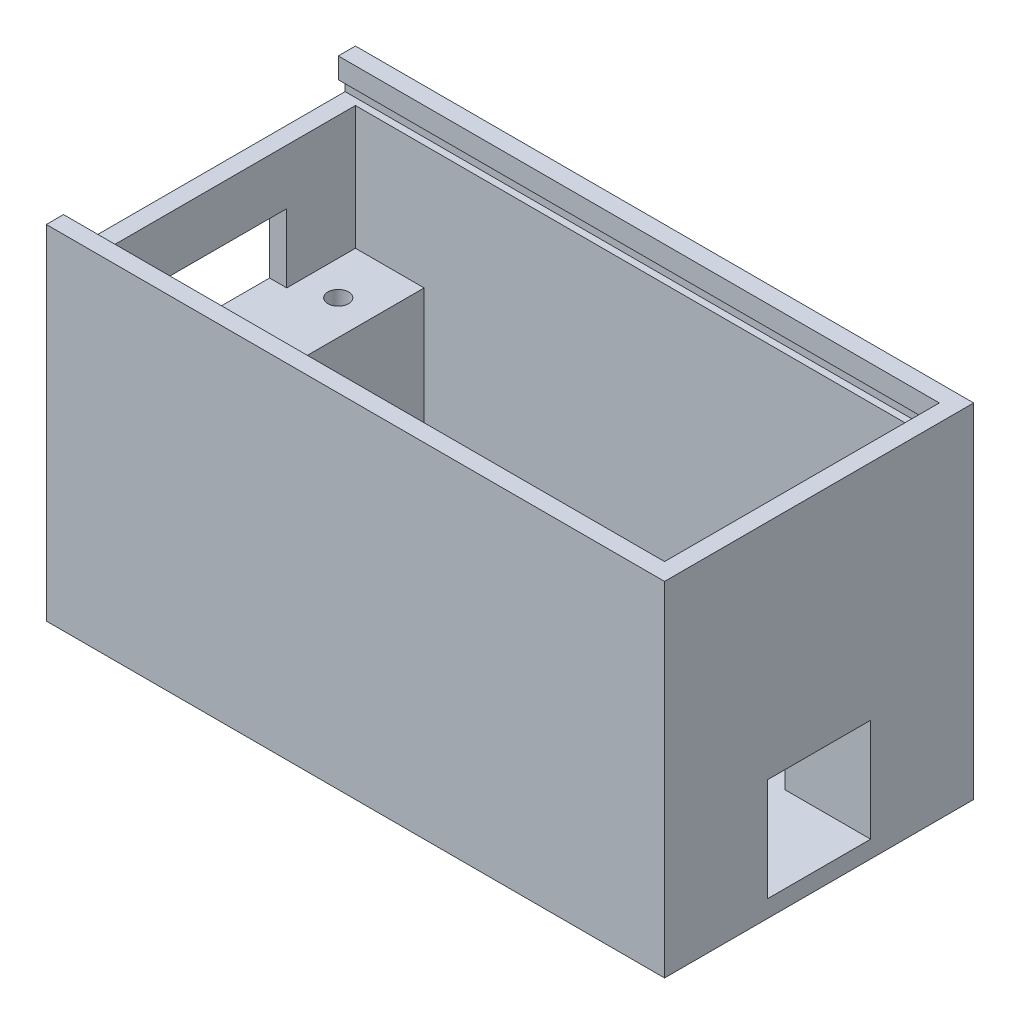
from build123d import *

# Parameters (mm, degrees)
SKETCH1_W           = 90
SKETCH1_H           = 45
BOSS_EXTRUDE1_DEPTH = 50
SHELL1_T            = -2.5
SKETCH2_W           = 40
SKETCH2_H           = 24.5
BOSS_EXTRUDE2_DEPTH = 10
SKETCH3_W           = 40
SKETCH3_H           = 19.5
BOSS_EXTRUDE3_DEPTH = 10
SKETCH9_W           = 20
SKETCH9_H           = 10
CUT_EXTRUDE3_DEPTH  = 2.5
SKETCH13_W          = 40
SKETCH13_H          = 5
CUT_EXTRUDE6_DEPTH  = 2.5
SKETCH14_W          = 87.5
SKETCH14_H          = 2
CUT_EXTRUDE7_DEPTH  = 1
SKETCH15_W          = 87.5
SKETCH15_H          = 2
CUT_EXTRUDE8_DEPTH  = 1
SKETCH17_R          = 1.5
CUT_EXTRUDE9_DEPTH  = 27
SKETCH18_R          = 1.5
CUT_EXTRUDE10_DEPTH = 27
SKETCH20_R          = 1.5
CUT_EXTRUDE11_DEPTH = 22
SKETCH21_R          = 1.5
CUT_EXTRUDE12_DEPTH = 22
SKETCH22_R          = 3
CUT_EXTRUDE13_DEPTH = 5
SKETCH26_W          = 15
SKETCH26_H          = 15
CUT_EXTRUDE14_DEPTH = 12.5


with BuildPart() as part:
    # Sketch1 → Boss-Extrude1 (new body)
    with BuildSketch(Plane(origin=(0, 0, 0), x_dir=(1, 0, 0), z_dir=(0, 1, 0))):
        with Locations((4.862356655, 3.4550978)):
            Rectangle(SKETCH1_W, SKETCH1_H)
    extrude(amount=BOSS_EXTRUDE1_DEPTH)

    # Shell1
    shell1_openings = [part.faces().sort_by_distance(p)[0] for p in [
        (4.862356655, 50, -3.4550978),
    ]]
    offset(amount=SHELL1_T, openings=shell1_openings, kind=Kind.INTERSECTION)

    # Sketch2 → Boss-Extrude2 (add)
    with BuildSketch(Plane(origin=(-37.637643345, 0, 0), x_dir=(0, 0, -1), z_dir=(1, 0, 0))):
        with Locations((3.4550978, 14.75)):
            Rectangle(SKETCH2_W, SKETCH2_H)
    extrude(amount=BOSS_EXTRUDE2_DEPTH)

    # Sketch3 → Boss-Extrude3 (add)
    with BuildSketch(Plane.ZY.offset(-47.362356655)):
        with Locations((-3.4550978, 12.25)):
            Rectangle(SKETCH3_W, SKETCH3_H)
    extrude(amount=BOSS_EXTRUDE3_DEPTH)

    # Sketch9 → Cut-Extrude3 (cut)
    with BuildSketch(Plane(origin=(-37.637643345, 0, 0), x_dir=(0, 0, -1), z_dir=(1, 0, 0))):
        with Locations((3.4550978, 32)):
            Rectangle(SKETCH9_W, SKETCH9_H)
    extrude(amount=-CUT_EXTRUDE3_DEPTH, mode=Mode.SUBTRACT)

    # Sketch13 → Cut-Extrude6 (cut)
    with BuildSketch(Plane(origin=(-37.637643345, 0, 0), x_dir=(0, 0, -1), z_dir=(1, 0, 0))):
        with Locations((3.4550978, 47.5)):
            Rectangle(SKETCH13_W, SKETCH13_H)
    extrude(amount=-CUT_EXTRUDE6_DEPTH, mode=Mode.SUBTRACT)

    # Sketch14 → Cut-Extrude7 (cut)
    with BuildSketch(Plane.XY.offset(-23.4550978)):
        with Locations((3.612356655, 46)):
            Rectangle(SKETCH14_W, SKETCH14_H)
    extrude(amount=-CUT_EXTRUDE7_DEPTH, mode=Mode.SUBTRACT)

    # Sketch15 → Cut-Extrude8 (cut)
    with BuildSketch(Plane(origin=(0, 0, 16.5449022), x_dir=(-1, 0, 0), z_dir=(0, 0, -1))):
        with Locations((-3.612356655, 46)):
            Rectangle(SKETCH15_W, SKETCH15_H)
    extrude(amount=-CUT_EXTRUDE8_DEPTH, mode=Mode.SUBTRACT)

    # Sketch17 → Cut-Extrude9 (cut)
    with BuildSketch(Plane(origin=(0, 27, 0), x_dir=(1, 0, 0), z_dir=(0, 1, 0))):
        with Locations(Location((-32.637643345, -9.0449022, 0), (0, 0, 270))):
            Circle(SKETCH17_R)
    extrude(amount=-CUT_EXTRUDE9_DEPTH, mode=Mode.SUBTRACT)

    # Sketch18 → Cut-Extrude10 (cut)
    with BuildSketch(Plane(origin=(0, 27, 0), x_dir=(1, 0, 0), z_dir=(0, 1, 0))):
        with Locations(Location((-32.637643345, 15.9550978, 0), (0, 0, 270))):
            Circle(SKETCH18_R)
    extrude(amount=-CUT_EXTRUDE10_DEPTH, mode=Mode.SUBTRACT)

    # Sketch20 → Cut-Extrude11 (cut)
    with BuildSketch(Plane(origin=(0, 22, 0), x_dir=(1, 0, 0), z_dir=(0, 1, 0))):
        with Locations(Location((42.362356655, 15.9550978, 0), (0, 0, 270))):
            Circle(SKETCH20_R)
    extrude(amount=-CUT_EXTRUDE11_DEPTH, mode=Mode.SUBTRACT)

    # Sketch21 → Cut-Extrude12 (cut)
    with BuildSketch(Plane(origin=(0, 22, 0), x_dir=(1, 0, 0), z_dir=(0, 1, 0))):
        with Locations(Location((42.362356655, -9.0449022, 0), (0, 0, 270))):
            Circle(SKETCH21_R)
    extrude(amount=-CUT_EXTRUDE12_DEPTH, mode=Mode.SUBTRACT)

    # Sketch22 → Cut-Extrude13 (cut)
    with BuildSketch(Plane.XZ):
        with Locations(Location((-32.637643345, -15.9550978, 0), (0, 0, 270))):
            Circle(SKETCH22_R)
        with Locations(Location((-32.637643345, 9.0449022, 0), (0, 0, 270))):
            Circle(SKETCH22_R)
        with Locations(Location((42.362356655, -15.9550978, 0), (0, 0, 270))):
            Circle(SKETCH22_R)
        with Locations(Location((42.362356655, 9.0449022, 0), (0, 0, 270))):
            Circle(SKETCH22_R)
    extrude(amount=-CUT_EXTRUDE13_DEPTH, mode=Mode.SUBTRACT)

    # Sketch26 → Cut-Extrude14 (cut)
    with BuildSketch(Plane.ZY.offset(-37.362356655)):
        with Locations((-3.4550978, 10)):
            Rectangle(SKETCH26_W, SKETCH26_H)
    extrude(amount=-CUT_EXTRUDE14_DEPTH, mode=Mode.SUBTRACT)


solid = part.part
